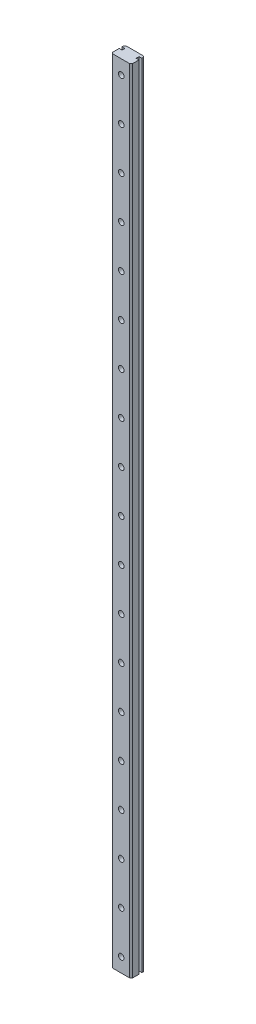
from build123d import *

# Parameters (mm, degrees)
EXTRUDE_1_DEPTH     = 280
SKETCH_2_R          = 1
CUT_EXTRUDE_1_DEPTH = 10
CHAMFER_1_SIZE      = 0.5
SKETCH_3_R          = 2.383304988
CUT_EXTRUDE_2_DEPTH = 1


with BuildPart() as part:
    # 草图1 → 凸台-拉伸1 (new body)
    with BuildSketch(Plane(origin=(0, 0, 0), x_dir=(1, 0, 0), z_dir=(0, 1, 0))):
        Polygon((-3.5, 0.4), (-3.5, -2.4), (3.5, -2.4), (3.5, 0.4), (2.5, 0.4), (2.5, 1.4), (3.5, 1.4), (3.5, 2.4), (-3.5, 2.4), (-3.5, 1.4), (-2.5, 1.4), (-2.5, 0.4), align=None)
    extrude(amount=EXTRUDE_1_DEPTH)

    # 草图2 → 切除-拉伸1 (cut)
    with BuildSketch(Plane(origin=(0, 0, -2.4), x_dir=(-1, 0, 0), z_dir=(0, 0, -1))):
        with Locations((0, 5)):
            Circle(SKETCH_2_R)
        with Locations((0, 20)):
            Circle(SKETCH_2_R)
        with Locations((0, 35)):
            Circle(SKETCH_2_R)
        with Locations((0, 50)):
            Circle(SKETCH_2_R)
        with Locations((0, 65)):
            Circle(SKETCH_2_R)
        with Locations((0, 80)):
            Circle(SKETCH_2_R)
        with Locations((0, 95)):
            Circle(SKETCH_2_R)
        with Locations((0, 110)):
            Circle(SKETCH_2_R)
        with Locations((0, 125)):
            Circle(SKETCH_2_R)
        with Locations((0, 140)):
            Circle(SKETCH_2_R)
        with Locations((0, 155)):
            Circle(SKETCH_2_R)
        with Locations((0, 170)):
            Circle(SKETCH_2_R)
        with Locations((0, 185)):
            Circle(SKETCH_2_R)
        with Locations((0, 200)):
            Circle(SKETCH_2_R)
        with Locations((0, 215)):
            Circle(SKETCH_2_R)
        with Locations((0, 230)):
            Circle(SKETCH_2_R)
        with Locations((0, 245)):
            Circle(SKETCH_2_R)
        with Locations((0, 260)):
            Circle(SKETCH_2_R)
        with Locations((0, 275)):
            Circle(SKETCH_2_R)
    extrude(amount=-CUT_EXTRUDE_1_DEPTH, mode=Mode.SUBTRACT)

    # 倒角1
    chamfer_1_edges = [part.edges().sort_by_distance(p)[0] for p in [
        (-3.5, 140, -2.4),
        (3.5, 140, -2.4),
        (3.5, 140, 2.4),
        (-3.5, 140, 2.4),
    ]]
    chamfer(chamfer_1_edges, length=CHAMFER_1_SIZE)

    # 草图3 → 切除-拉伸2 (cut)
    with BuildSketch(Plane(origin=(0, 0, -2.4), x_dir=(-1, 0, 0), z_dir=(0, 0, -1))):
        with Locations((0, 5)):
            Circle(SKETCH_3_R)
        with Locations((0, 20)):
            Circle(SKETCH_3_R)
        with Locations((0, 35)):
            Circle(SKETCH_3_R)
        with Locations((0, 50)):
            Circle(SKETCH_3_R)
        with Locations((0, 65)):
            Circle(SKETCH_3_R)
        with Locations((0, 80)):
            Circle(SKETCH_3_R)
        with Locations((0, 95)):
            Circle(SKETCH_3_R)
        with Locations((0, 110)):
            Circle(SKETCH_3_R)
        with Locations((0, 125)):
            Circle(SKETCH_3_R)
        with Locations((0, 140)):
            Circle(SKETCH_3_R)
        with Locations((0, 155)):
            Circle(SKETCH_3_R)
        with Locations((0, 170)):
            Circle(SKETCH_3_R)
        with Locations((0, 185)):
            Circle(SKETCH_3_R)
        with Locations((0, 200)):
            Circle(SKETCH_3_R)
        with Locations((0, 215)):
            Circle(SKETCH_3_R)
        with Locations((0, 230)):
            Circle(SKETCH_3_R)
        with Locations((0, 245)):
            Circle(SKETCH_3_R)
        with Locations((0, 260)):
            Circle(SKETCH_3_R)
        with Locations((0, 275)):
            Circle(SKETCH_3_R)
    extrude(amount=-CUT_EXTRUDE_2_DEPTH, mode=Mode.SUBTRACT)


solid = part.part
